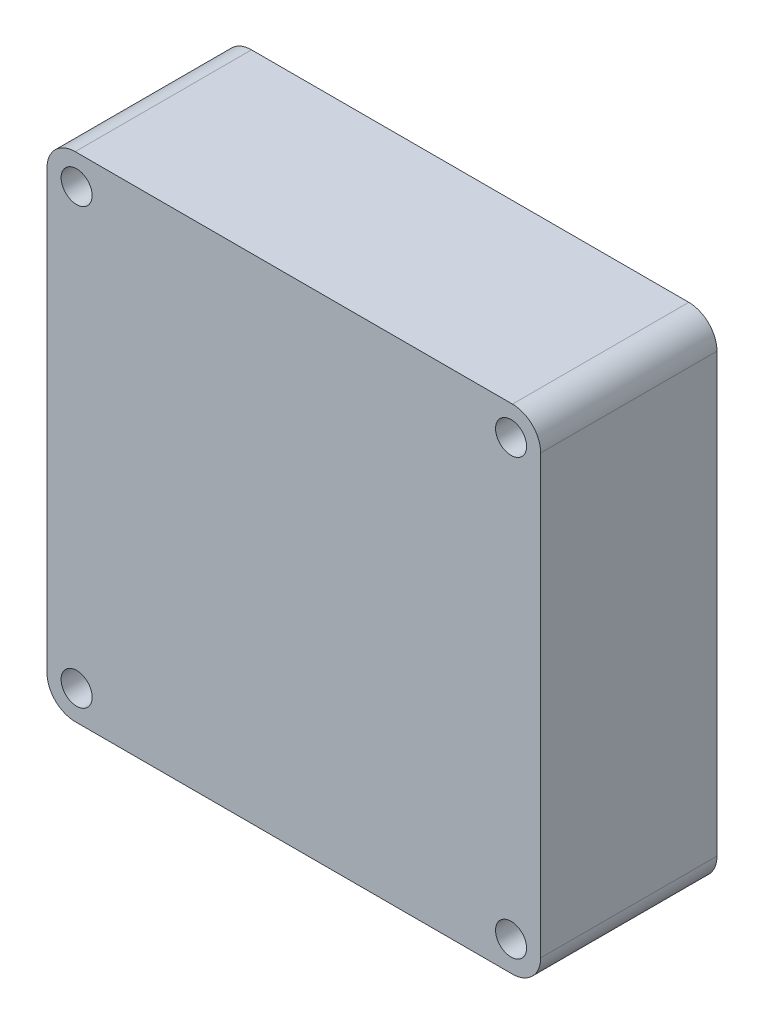
from build123d import *

# Parameters (mm, degrees)
SKETCH1_W           = 70
SKETCH1_H           = 70
BOSS_EXTRUDE1_DEPTH = 25
SKETCH2_R           = 2.2
CUT_EXTRUDE1_DEPTH  = 56.452682532
FILLET1_R           = 4


with BuildPart() as part:
    # Sketch1 → Boss-Extrude1 (new body)
    with BuildSketch(Plane.XY):
        Rectangle(SKETCH1_W, SKETCH1_H)
    extrude(amount=BOSS_EXTRUDE1_DEPTH)

    # Sketch2 → Cut-Extrude1 (cut, through all)
    with BuildSketch(Plane.XY.offset(25)):
        with Locations((-30.8, 30.8)):
            Circle(SKETCH2_R)
        with Locations((30.8, 30.8)):
            Circle(SKETCH2_R)
        with Locations((30.8, -30.8)):
            Circle(SKETCH2_R)
        with Locations((-30.8, -30.8)):
            Circle(SKETCH2_R)
    extrude(amount=-CUT_EXTRUDE1_DEPTH, mode=Mode.SUBTRACT)

    # Fillet1
    fillet1_edges = [part.edges().sort_by_distance(p)[0] for p in [
        (35, -35, 12.5),
        (-35, -35, 12.5),
        (-35, 35, 12.5),
        (35, 35, 12.5),
    ]]
    fillet(fillet1_edges, radius=FILLET1_R)


solid = part.part
